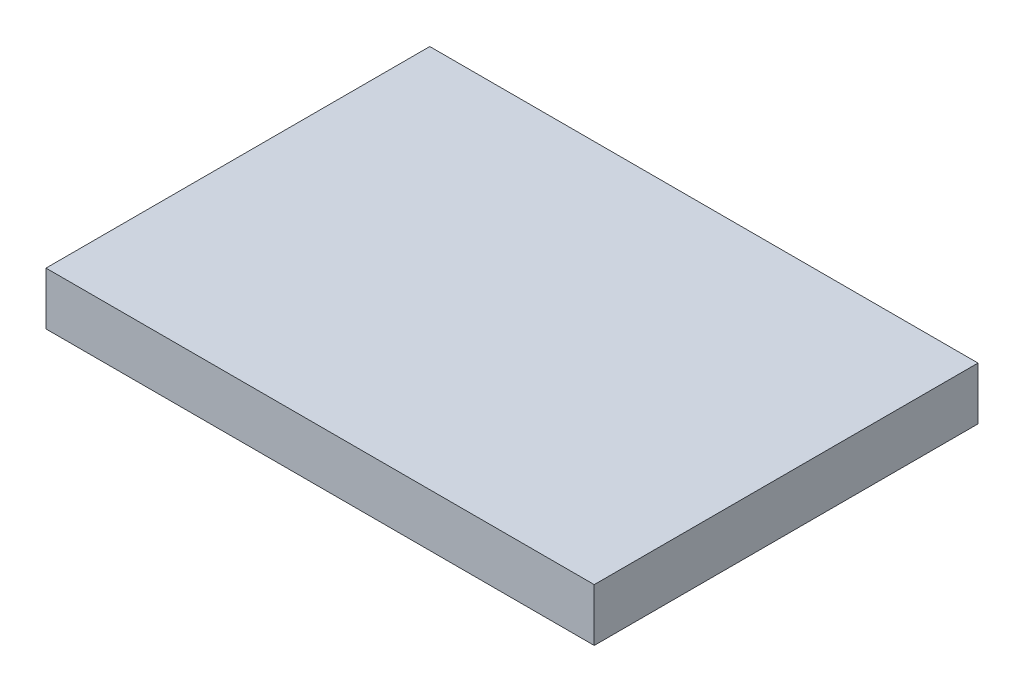
from build123d import *

# Parameters (mm, degrees)
SKETCH1_W           = 33.02
SKETCH1_H           = 23.114
BOSS_EXTRUDE1_DEPTH = 3.175


with BuildPart() as part:
    # Sketch1 → Boss-Extrude1 (new body)
    with BuildSketch(Plane(origin=(0, 0, 0), x_dir=(1, 0, 0), z_dir=(0, 1, 0))):
        Rectangle(SKETCH1_W, SKETCH1_H)
    extrude(amount=BOSS_EXTRUDE1_DEPTH)


solid = part.part
